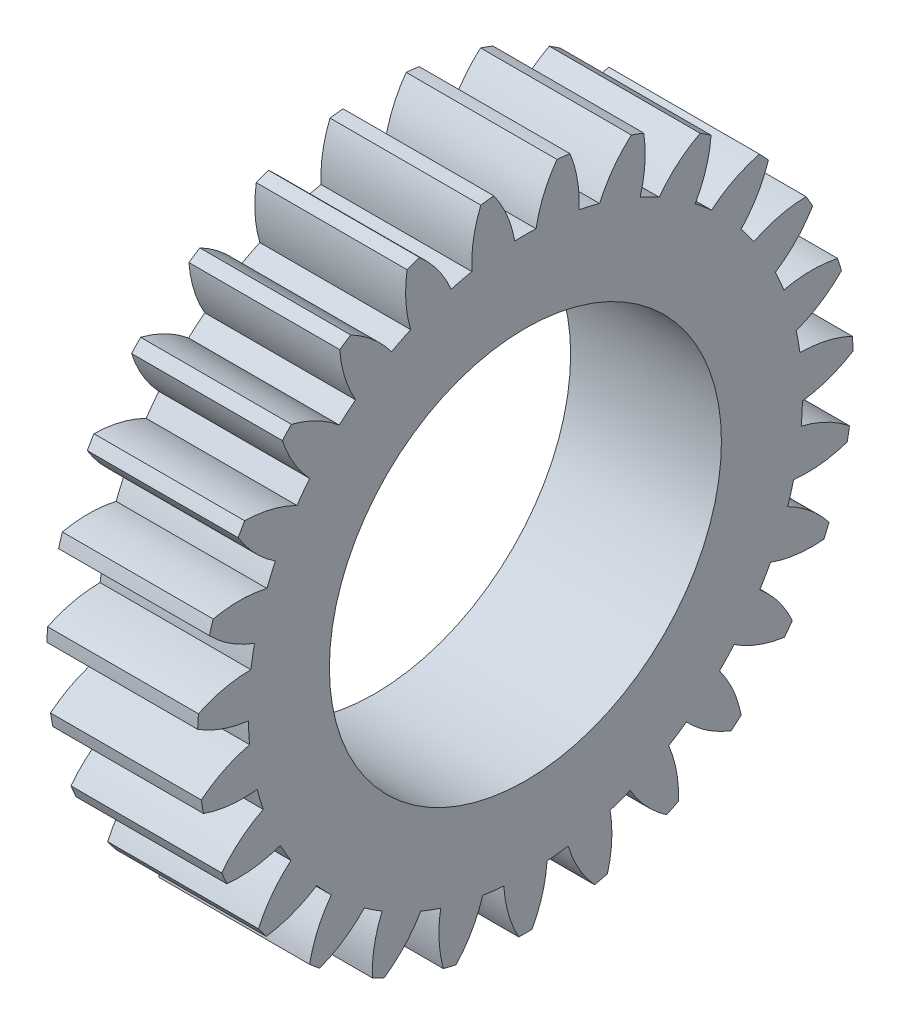
from build123d import *

# Parameters (mm, degrees)
BASPROSKE_W     = 10
BASPROSKE_H     = 21.75
TOOTHCUT_DEPTH  = 33.343855676
TEETHCUTS_COUNT = 27
TEETHCUTS_ANGLE = 346.666666667
BORSKE_R        = 13
BORE_DEPTH      = 50.0000508


with BuildPart() as part:
    # BasProSke → Base-Revolve (revolve)
    with BuildSketch(Plane(origin=(0, 0, 0), x_dir=(1, 0, 0), z_dir=(0, 1, 0)), mode=Mode.PRIVATE) as base_revolve_sk:
        with Locations((5, 10.875)):
            Rectangle(BASPROSKE_W, BASPROSKE_H)
    revolve(base_revolve_sk.sketch.rotate(Axis((-10, 0, 0), (1, 0, 0)), 180), axis=Axis((-10, 0, 0), (1, 0, 0)))

    # TooCutSke → ToothCut (cut, through all)
    with BuildSketch(Plane(origin=(0, 0, 0), x_dir=(0, 0, -1), z_dir=(1, 0, 0))):
        with BuildLine():
            ThreePointArc((0.704815466, 18.360476877), (0, 18.374), (-0.704815466, 18.360476877))
            ThreePointArc((-0.704815466, 18.360476877), (-1.220614561, 20.095701504), (-2.108907523, 21.673037494))
            ThreePointArc((-2.108907523, 21.673037494), (0, 21.7754), (2.108907523, 21.673037494))
            ThreePointArc((2.108907523, 21.673037494), (1.220614561, 20.095701504), (0.704815466, 18.360476877))
        make_face()
    toothcut = extrude(amount=TOOTHCUT_DEPTH, mode=Mode.SUBTRACT)

    # TeethCuts: ToothCut ×27 about axis
    teethcuts_axis = Axis((-10, 0, 0), (1, 0, 0))
    for i in range(1, TEETHCUTS_COUNT):
        add(toothcut.rotate(teethcuts_axis, i * TEETHCUTS_ANGLE / (TEETHCUTS_COUNT - 1)), mode=Mode.SUBTRACT)

    # BorSke → Bore (cut, symmetric)
    with BuildSketch(Plane(origin=(0, 0, 0), x_dir=(0, 0, -1), z_dir=(1, 0, 0))):
        with Locations(Location((0, 0, 0), (0, 0, 180))):
            Circle(BORSKE_R)
    extrude(amount=BORE_DEPTH, both=True, mode=Mode.SUBTRACT)


solid = part.part
